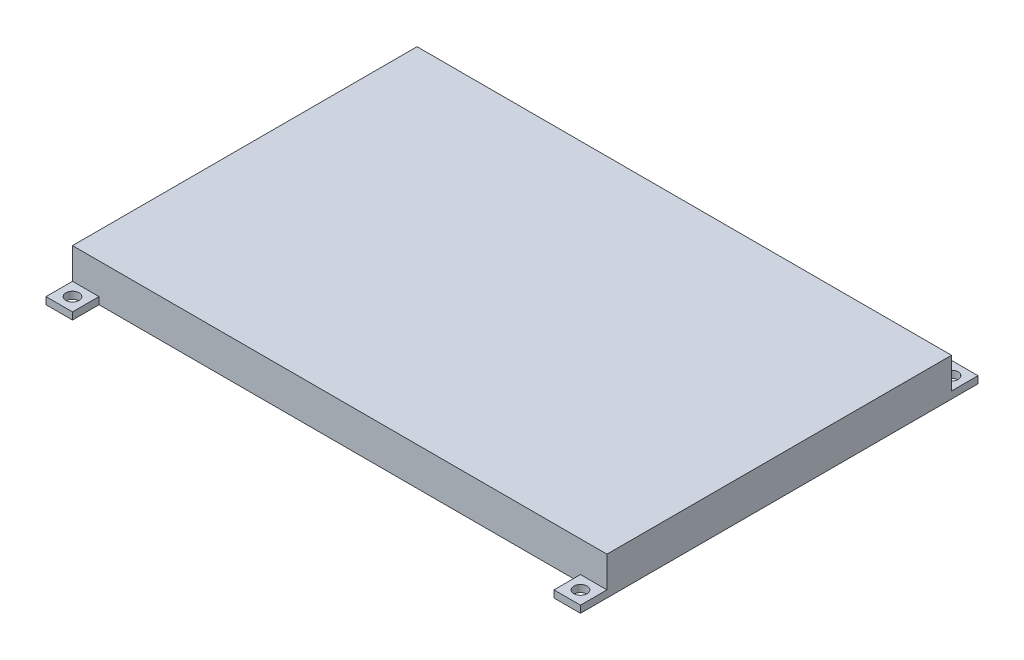
from build123d import *

# Parameters (mm, degrees)
SKETCH1_R           = 1.5
BOSS_EXTRUDE1_DEPTH = 1.6
SKETCH2_W           = 121
SKETCH2_H           = 78
BOSS_EXTRUDE2_DEPTH = 7


with BuildPart() as part:
    # Sketch1 → Boss-Extrude1 (new body)
    with BuildSketch(Plane(origin=(0, 0, 0), x_dir=(1, 0, 0), z_dir=(0, 1, 0))):
        Polygon((-166.842260972, 58.195002586), (-166.842260972, -19.804997414), (-166.842260972, -25.804997414), (-160.842260972, -25.804997414), (-160.842260972, -19.804997414), (-51.842260972, -19.804997414), (-51.842260972, -25.804997414), (-45.842260972, -25.804997414), (-45.842260972, -19.804997414), (-45.842260972, 58.195002586), (-45.842260972, 64.195002586), (-51.842260972, 64.195002586), (-51.842260972, 58.195002586), (-160.842260972, 58.195002586), (-160.842260972, 64.195002586), (-166.842260972, 64.195002586), align=None)
        with Locations(Location((-48.842260972, -22.804997414, 0), (0, 0, 270))):
            Circle(SKETCH1_R, mode=Mode.SUBTRACT)
        with Locations(Location((-163.842260972, -22.804997414, 0), (0, 0, 270))):
            Circle(SKETCH1_R, mode=Mode.SUBTRACT)
        with Locations(Location((-48.842260972, 61.195002586, 0), (0, 0, 90))):
            Circle(SKETCH1_R, mode=Mode.SUBTRACT)
        with Locations(Location((-163.842260972, 61.195002586, 0), (0, 0, 90))):
            Circle(SKETCH1_R, mode=Mode.SUBTRACT)
    extrude(amount=BOSS_EXTRUDE1_DEPTH)

    # Sketch2 → Boss-Extrude2 (add)
    with BuildSketch(Plane(origin=(0, 1.6, 0), x_dir=(1, 0, 0), z_dir=(0, 1, 0))):
        with Locations((-106.342260972, 19.195002586)):
            Rectangle(SKETCH2_W, SKETCH2_H)
    extrude(amount=BOSS_EXTRUDE2_DEPTH)


solid = part.part
